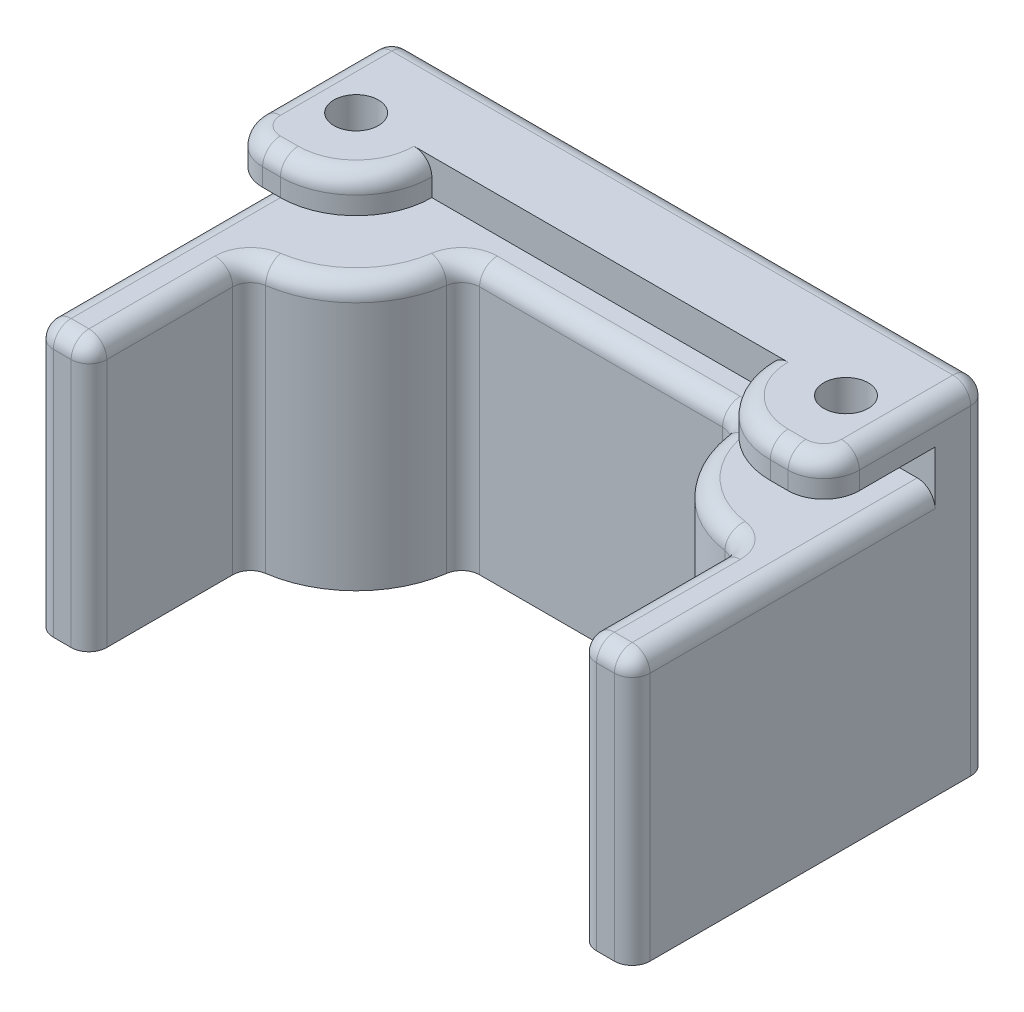
from build123d import *

# Parameters (mm, degrees)
MAIN_BODY_DEPTH                = 15
EXTENSION_FOR_TOP_FLANGE_DEPTH = 2
SKETCH4_R                      = 1.25
TOP_CAMERA_FLANGE_DEPTH        = 2
M2_SCREWHOLE_DEPTH             = 28.028919697
M2_SCREWHOLE_DEPTH_BACK        = 28.028919697
SKETCH5_R                      = 1
FILLET1_R                      = 1


with BuildPart() as part:
    # Sketch2 → Main body (new body)
    with BuildSketch(Plane(origin=(0, 0, 0), x_dir=(1, 0, 0), z_dir=(0, 1, 0))):
        with BuildLine():
            Line((-16.75, -14), (-16.75, 4))
            ThreePointArc((-16.75, 4), (-16.457106781, 4.707106781), (-15.75, 5))
            Line((-15.75, 5), (15.75, 5))
            ThreePointArc((15.75, 5), (16.457106781, 4.707106781), (16.75, 4))
            Line((16.75, 4), (16.75, -14))
            ThreePointArc((16.75, -14), (16.457106781, -14.707106781), (15.75, -15))
            Line((15.75, -15), (14.75, -15))
            ThreePointArc((14.75, -15), (14.042893219, -14.707106781), (13.75, -14))
            Line((13.75, -14), (13.75, -6.92820323))
            ThreePointArc((13.75, -6.92820323), (13.505928946, -6.27354956), (12.892857143, -5.938459912))
            ThreePointArc((12.892857143, -5.938459912), (9.507359313, -4.242640687), (7.811540088, -0.857142857))
            ThreePointArc((7.811540088, -0.857142857), (7.47645044, -0.244071054), (6.82179677, 0))
            Line((6.82179677, 0), (-6.82179677, 0))
            ThreePointArc((-6.82179677, 0), (-7.47645044, -0.244071054), (-7.811540088, -0.857142857))
            ThreePointArc((-7.811540088, -0.857142857), (-9.507359313, -4.242640687), (-12.892857143, -5.938459912))
            ThreePointArc((-12.892857143, -5.938459912), (-13.505928946, -6.27354956), (-13.75, -6.92820323))
            Line((-13.75, -6.92820323), (-13.75, -14))
            ThreePointArc((-13.75, -14), (-14.042893219, -14.707106781), (-14.75, -15))
            Line((-14.75, -15), (-15.75, -15))
            ThreePointArc((-15.75, -15), (-16.457106781, -14.707106781), (-16.75, -14))
        make_face()
    extrude(amount=MAIN_BODY_DEPTH)

    # Sketch3 → Extension for top flange (add)
    with BuildSketch(Plane(origin=(0, 15, 0), x_dir=(1, 0, 0), z_dir=(0, 1, 0))):
        with BuildLine():
            Line((16.75, 2), (16.75, 4))
            ThreePointArc((16.75, 4), (16.457106781, 4.707106781), (15.75, 5))
            Line((15.75, 5), (-15.75, 5))
            ThreePointArc((-15.75, 5), (-16.457106781, 4.707106781), (-16.75, 4))
            Line((-16.75, 4), (-16.75, 2))
            Line((-16.75, 2), (16.75, 2))
        make_face()
    extrude(amount=EXTENSION_FOR_TOP_FLANGE_DEPTH)

    # Sketch4 → Top camera flange (add)
    with BuildSketch(Plane(origin=(0, 17, 0), x_dir=(1, 0, 0), z_dir=(0, 1, 0))):
        with BuildLine():
            Line((16.75, -2.25), (16.75, 2))
            Line((16.75, 2), (16.75, 4))
            ThreePointArc((16.75, 4), (16.457106781, 4.707106781), (15.75, 5))
            Line((15.75, 5), (-15.75, 5))
            ThreePointArc((-15.75, 5), (-16.457106781, 4.707106781), (-16.75, 4))
            Line((-16.75, 4), (-16.75, 2))
            Line((-16.75, 2), (-16.75, -2.25))
            ThreePointArc((-16.75, -2.25), (-16.164213562, -3.664213562), (-14.75, -4.25))
            Line((-14.75, -4.25), (-13.75, -4.25))
            ThreePointArc((-13.75, -4.25), (-10.74479618, -3.00520382), (-9.5, 0))
            Line((-9.5, 0), (9.5, 0))
            ThreePointArc((9.5, 0), (10.74479618, -3.00520382), (13.75, -4.25))
            Line((13.75, -4.25), (14.75, -4.25))
            ThreePointArc((14.75, -4.25), (16.164213562, -3.664213562), (16.75, -2.25))
        make_face()
        with Locations(Location((-13.75, 0, 0), (0, 0, 270))):
            Circle(SKETCH4_R, mode=Mode.SUBTRACT)
        with Locations(Location((13.75, 0, 0), (0, 0, 270))):
            Circle(SKETCH4_R, mode=Mode.SUBTRACT)
    extrude(amount=TOP_CAMERA_FLANGE_DEPTH)

    # Sketch5 → M2 screwhole (cut, two sides: drawn at the far end of the back side and taken through both)
    with BuildSketch(Plane(origin=(0, 15, 0), x_dir=(1, 0, 0), z_dir=(0, 1, 0)).offset(-M2_SCREWHOLE_DEPTH_BACK)):
        with Locations(Location((-13.75, 0, 0), (0, 0, 270))):
            Circle(SKETCH5_R)
        with Locations(Location((13.75, 0, 0), (0, 0, 270))):
            Circle(SKETCH5_R)
    extrude(amount=M2_SCREWHOLE_DEPTH + M2_SCREWHOLE_DEPTH_BACK, mode=Mode.SUBTRACT)

    # Fillet1
    fillet1_edges = [part.edges().sort_by_distance(p)[0] for p in [
        (-13.505928946, 15, 6.27354956),
        (-9.507359313, 15, 4.242640687),
        (-7.47645044, 15, 0.244071054),
        (0, 15, 0),
        (7.47645044, 15, 0.244071054),
        (9.507359313, 15, 4.242640687),
        (13.505928946, 15, 6.27354956),
        (13.75, 15, 10.464101615),
        (14.042893219, 15, 14.707106781),
        (15.25, 15, 15),
        (-14.042893219, 15, 14.707106781),
        (16.457106781, 15, 14.707106781),
        (16.75, 15, 6),
        (-16.75, 15, 6),
        (-16.457106781, 15, 14.707106781),
        (-15.25, 15, 15),
        (16.75, 19, -0.875),
        (16.457106781, 19, -4.707106781),
        (0, 19, -5),
        (-16.457106781, 19, -4.707106781),
        (-16.75, 19, -0.875),
        (-16.164213562, 19, 3.664213562),
        (-14.25, 19, 4.25),
        (-10.74479618, 19, 3.00520382),
        (10.74479618, 19, 3.00520382),
        (14.25, 19, 4.25),
        (16.164213562, 19, 3.664213562),
        (-13.75, 15, 10.464101615),
    ]]
    fillet(fillet1_edges, radius=FILLET1_R)


solid = part.part
